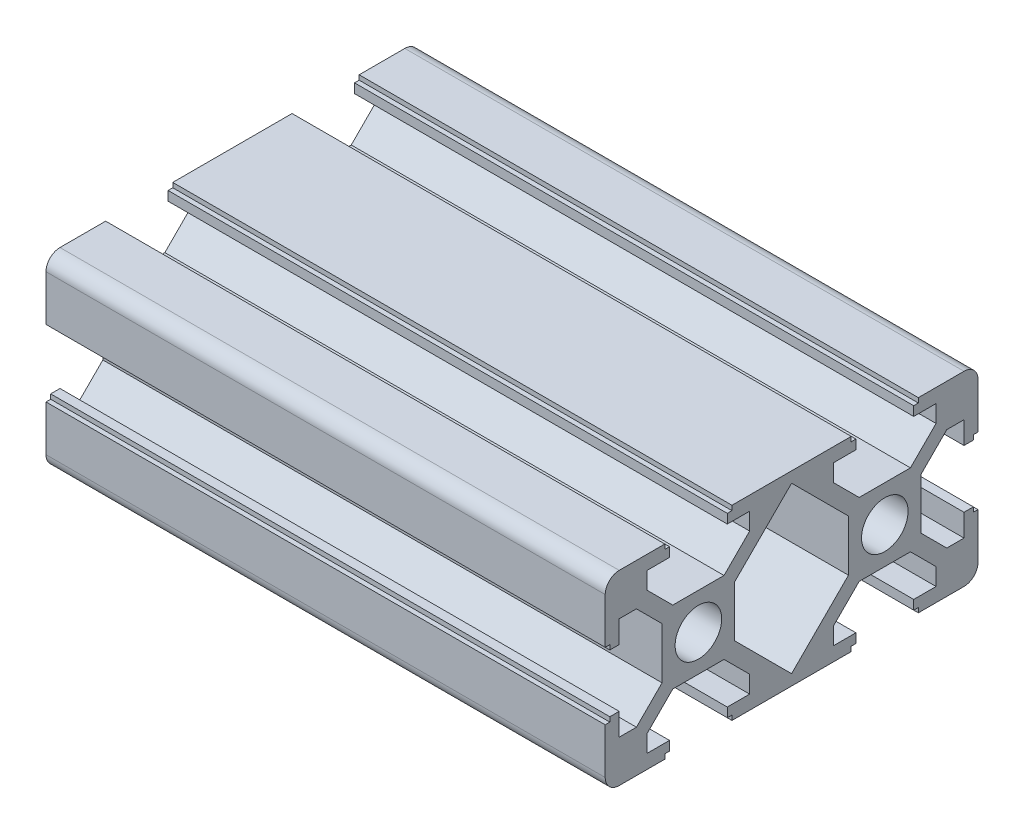
from build123d import *

# Parameters (mm, degrees)
SKETCH16_R           = 2.5
F_20X40XR1_5_2_DEPTH = 60


with BuildPart() as part:
    # Sketch16 → 铝型材 20X40XR1.5(2) (new body)
    with BuildSketch(Plane(origin=(-53.342500755, -1.452155193, 0), x_dir=(0, 1, 0), z_dir=(1, 0, 0))):
        with BuildLine():
            Line((-3.6, 10), (-3.6, 9.5))
            Line((-3.6, 9.5), (-3.1, 9.5))
            Line((-3.1, 9.5), (-3.1, 8.5))
            Line((-3.1, 8.5), (-5.5, 8.5))
            Line((-5.5, 8.5), (-5.5, 6.65))
            Line((-5.5, 6.65), (-2.75, 3.9))
            Line((-2.75, 3.9), (2.75, 3.9))
            Line((2.75, 3.9), (5.5, 6.65))
            Line((5.5, 6.65), (5.5, 8.5))
            Line((5.5, 8.5), (3.1, 8.5))
            Line((3.1, 8.5), (3.1, 9.5))
            Line((3.1, 9.5), (3.6, 9.5))
            Line((3.6, 9.5), (3.6, 10))
            Line((3.6, 10), (8.5, 10))
            ThreePointArc((8.5, 10), (9.560660172, 9.560660172), (10, 8.5))
            Line((10, 8.5), (10, 3.6))
            Line((10, 3.6), (9.5, 3.6))
            Line((9.5, 3.6), (9.5, 3.1))
            Line((9.5, 3.1), (8.5, 3.1))
            Line((8.5, 3.1), (8.5, 5.5))
            Line((8.5, 5.5), (6.65, 5.5))
            Line((6.65, 5.5), (3.9, 2.75))
            Line((3.9, 2.75), (3.9, -2.75))
            Line((3.9, -2.75), (6.65, -5.5))
            Line((6.65, -5.5), (8.5, -5.5))
            Line((8.5, -5.5), (8.5, -3.1))
            Line((8.5, -3.1), (9.5, -3.1))
            Line((9.5, -3.1), (9.5, -3.6))
            Line((9.5, -3.6), (10, -3.6))
            Line((10, -3.6), (10, -16.4))
            Line((10, -16.4), (9.5, -16.4))
            Line((9.5, -16.4), (9.5, -16.9))
            Line((9.5, -16.9), (8.5, -16.9))
            Line((8.5, -16.9), (8.5, -14.5))
            Line((8.5, -14.5), (6.65, -14.5))
            Line((6.65, -14.5), (3.9, -17.25))
            Line((3.9, -17.25), (3.9, -22.75))
            Line((3.9, -22.75), (6.65, -25.5))
            Line((6.65, -25.5), (8.5, -25.5))
            Line((8.5, -25.5), (8.5, -23.1))
            Line((8.5, -23.1), (9.5, -23.1))
            Line((9.5, -23.1), (9.5, -23.6))
            Line((9.5, -23.6), (10, -23.6))
            Line((10, -23.6), (10, -28.5))
            ThreePointArc((10, -28.5), (9.560660172, -29.560660172), (8.5, -30))
            Line((8.5, -30), (3.6, -30))
            Line((3.6, -30), (3.6, -29.5))
            Line((3.6, -29.5), (3.1, -29.5))
            Line((3.1, -29.5), (3.1, -28.5))
            Line((3.1, -28.5), (5.5, -28.5))
            Line((5.5, -28.5), (5.5, -26.65))
            Line((5.5, -26.65), (2.75, -23.9))
            Line((2.75, -23.9), (-2.75, -23.9))
            Line((-2.75, -23.9), (-5.5, -26.65))
            Line((-5.5, -26.65), (-5.5, -28.5))
            Line((-5.5, -28.5), (-3.1, -28.5))
            Line((-3.1, -28.5), (-3.1, -29.5))
            Line((-3.1, -29.5), (-3.6, -29.5))
            Line((-3.6, -29.5), (-3.6, -30))
            Line((-3.6, -30), (-8.5, -30))
            ThreePointArc((-8.5, -30), (-9.560660172, -29.560660172), (-10, -28.5))
            Line((-10, -28.5), (-10, -23.6))
            Line((-10, -23.6), (-9.5, -23.6))
            Line((-9.5, -23.6), (-9.5, -23.1))
            Line((-9.5, -23.1), (-8.5, -23.1))
            Line((-8.5, -23.1), (-8.5, -25.5))
            Line((-8.5, -25.5), (-6.65, -25.5))
            Line((-6.65, -25.5), (-3.9, -22.75))
            Line((-3.9, -22.75), (-3.9, -17.25))
            Line((-3.9, -17.25), (-6.65, -14.5))
            Line((-6.65, -14.5), (-8.5, -14.5))
            Line((-8.5, -14.5), (-8.5, -16.9))
            Line((-8.5, -16.9), (-9.5, -16.9))
            Line((-9.5, -16.9), (-9.5, -16.4))
            Line((-9.5, -16.4), (-10, -16.4))
            Line((-10, -16.4), (-10, -3.6))
            Line((-10, -3.6), (-9.5, -3.6))
            Line((-9.5, -3.6), (-9.5, -3.1))
            Line((-9.5, -3.1), (-8.5, -3.1))
            Line((-8.5, -3.1), (-8.5, -5.5))
            Line((-8.5, -5.5), (-6.65, -5.5))
            Line((-6.65, -5.5), (-3.9, -2.75))
            Line((-3.9, -2.75), (-3.9, 2.75))
            Line((-3.9, 2.75), (-6.65, 5.5))
            Line((-6.65, 5.5), (-8.5, 5.5))
            Line((-8.5, 5.5), (-8.5, 3.1))
            Line((-8.5, 3.1), (-9.5, 3.1))
            Line((-9.5, 3.1), (-9.5, 3.6))
            Line((-9.5, 3.6), (-10, 3.6))
            Line((-10, 3.6), (-10, 8.5))
            ThreePointArc((-10, 8.5), (-9.560660172, 9.560660172), (-8.5, 10))
            Line((-8.5, 10), (-3.6, 10))
        make_face()
        Circle(SKETCH16_R, mode=Mode.SUBTRACT)
        with Locations((0, -20)):
            Circle(SKETCH16_R, mode=Mode.SUBTRACT)
        Polygon((8.85, -10), (2.75, -3.9), (-2.75, -3.9), (-8.85, -10), (-2.75, -16.1), (2.75, -16.1), align=None, mode=Mode.SUBTRACT)
    extrude(amount=F_20X40XR1_5_2_DEPTH)


solid = part.part
